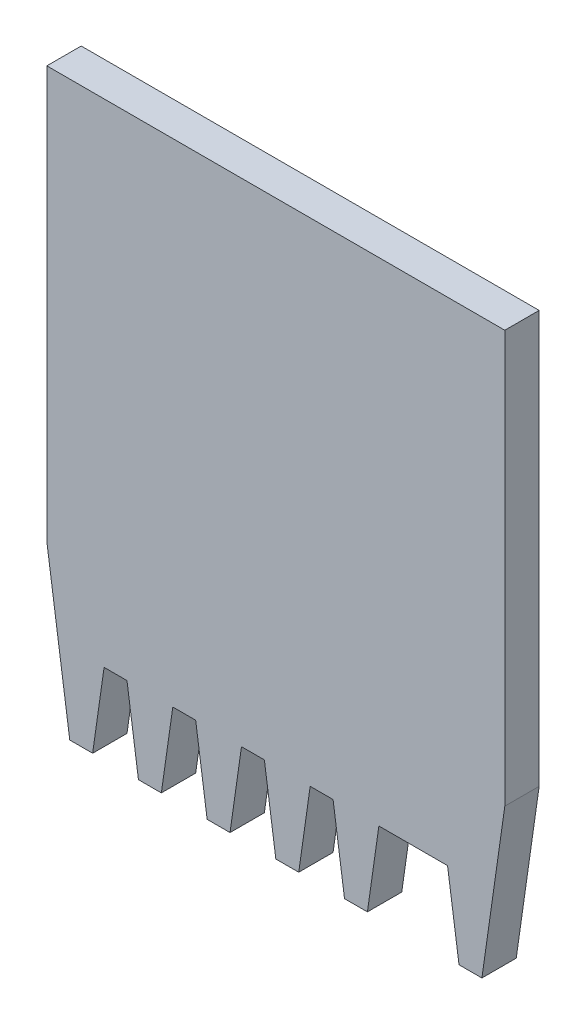
from build123d import *

# Parameters (mm, degrees)
BOSS_EXTRUDE1_DEPTH = 1.5


with BuildPart() as part:
    # Sketch1 → Boss-Extrude1 (new body)
    with BuildSketch(Plane.XY):
        Polygon((0, 7), (1, 0), (2, 0), (2.5, 3.5), (3.5, 3.5), (4, 0), (5, 0), (5.5, 3.5), (6.5, 3.5), (7, 0), (8, 0), (8.5, 3.5), (9.5, 3.5), (10, 0), (11, 0), (11.5, 3.5), (12.5, 3.5), (13, 0), (14, 0), (14.5, 3.5), (17.5, 3.5), (18, 0), (19, 0), (20, 7), (20, 25), (0, 25), align=None)
    extrude(amount=BOSS_EXTRUDE1_DEPTH)


solid = part.part
